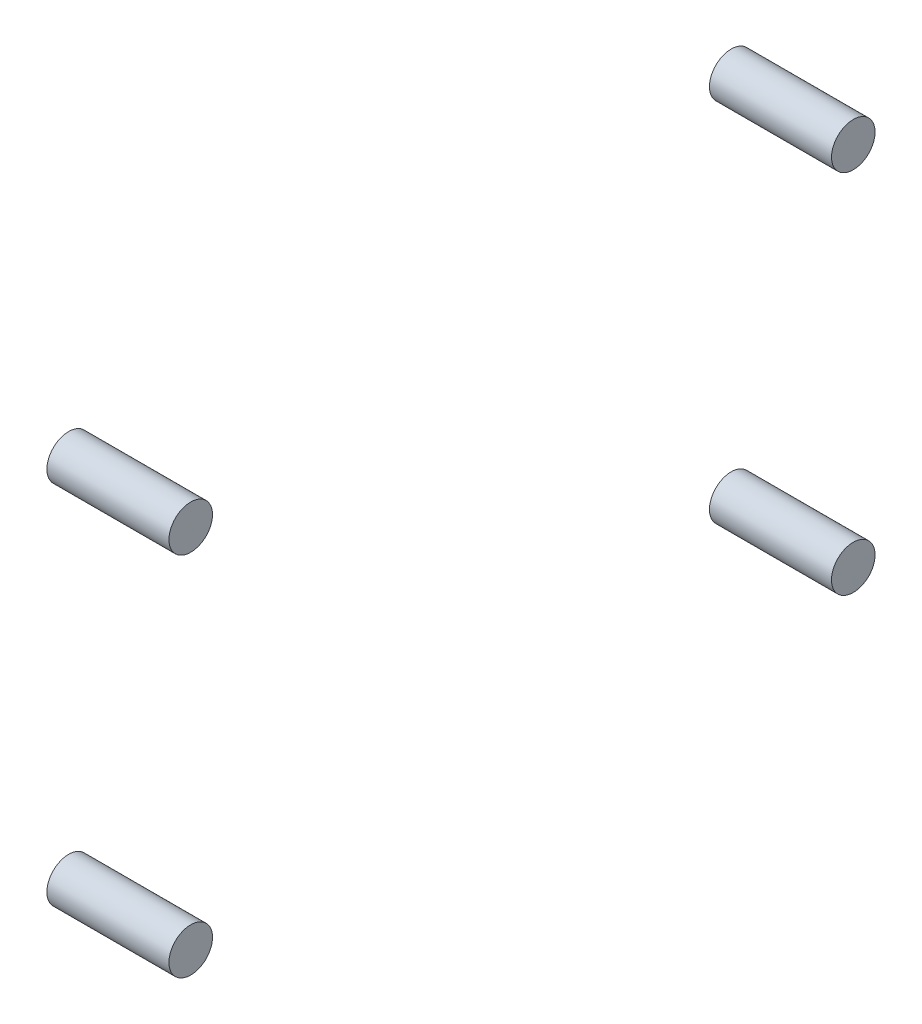
from build123d import *

# Parameters (mm, degrees)
SKETCH2_R                            = 1.25
BOSS_EXTRUDE1_DEPTH                  = 7
BOSS_EXTRUDE1_2_DEPTH                = 7
BOSS_EXTRUDE1_3_DEPTH                = 7
BOSS_EXTRUDE1_4_DEPTH                = 7
F_45_0_082_DIAMETER_HOLE1_AT_2_COUNT = 2
F_45_0_082_DIAMETER_HOLE1_AT_2_PITCH = 38
F_45_0_082_DIAMETER_HOLE1_AT_3_COUNT = 2
F_45_0_082_DIAMETER_HOLE1_AT_3_PITCH = 43.416586692
F_45_0_082_DIAMETER_HOLE1_AT_4_COUNT = 2
F_45_0_082_DIAMETER_HOLE1_AT_4_PITCH = 21


with BuildPart() as part:
    # Sketch2 → Boss-Extrude1 (new body)
    with BuildSketch(Plane(origin=(0, 0, 0), x_dir=(0, 0, -1), z_dir=(1, 0, 0))):
        with Locations((75.89, 6.426291501)):
            Circle(SKETCH2_R)
    extrude(amount=-BOSS_EXTRUDE1_DEPTH)


with BuildPart() as body_2:
    # Sketch2 → Boss-Extrude1 2 (new body)
    with BuildSketch(Plane(origin=(0, 0, 0), x_dir=(0, 0, -1), z_dir=(1, 0, 0))):
        with Locations((37.89, 6.426291501)):
            Circle(SKETCH2_R)
    extrude(amount=-BOSS_EXTRUDE1_2_DEPTH)


with BuildPart() as body_3:
    # Sketch2 → Boss-Extrude1 3 (new body)
    with BuildSketch(Plane(origin=(0, 0, 0), x_dir=(0, 0, -1), z_dir=(1, 0, 0))):
        with Locations((37.89, -14.573708499)):
            Circle(SKETCH2_R)
    extrude(amount=-BOSS_EXTRUDE1_3_DEPTH)

    # Sketch4 → #45 (0.082) Diameter Hole1 (revolve, cut)
    with BuildSketch(Plane(origin=(-7, -14.573708499, -37.89), x_dir=(0, 0, 1), z_dir=(0, 1, 0))):
        Polygon((0, 0), (0, 6), (1.0414, 5.374263751), (1.0414, 0), align=None)
    f_45_0_082_diameter_hole1 = revolve(axis=Axis((-13.35, -14.573708499, -37.89), (1, 0, 0)), mode=Mode.SUBTRACT)


with BuildPart() as body_4:
    # Sketch2 → Boss-Extrude1 4 (new body)
    with BuildSketch(Plane(origin=(0, 0, 0), x_dir=(0, 0, -1), z_dir=(1, 0, 0))):
        with Locations((75.89, -14.573708499)):
            Circle(SKETCH2_R)
    extrude(amount=-BOSS_EXTRUDE1_4_DEPTH)

    # #45 (0.082) Diameter Hole1 at 2: #45 (0.082) Diameter Hole1 ×2
    with Locations(*[(0, 0, -i * F_45_0_082_DIAMETER_HOLE1_AT_2_PITCH) for i in range(1, F_45_0_082_DIAMETER_HOLE1_AT_2_COUNT)]):
        add(f_45_0_082_diameter_hole1, mode=Mode.SUBTRACT)


with BuildPart() as part_1:
    add(part.part)

    # #45 (0.082) Diameter Hole1 at 3: #45 (0.082) Diameter Hole1 ×2
    with Locations(*[Vector(0, 0.4836861116901228, -0.8752415354392695) * (i * F_45_0_082_DIAMETER_HOLE1_AT_3_PITCH) for i in range(1, F_45_0_082_DIAMETER_HOLE1_AT_3_COUNT)]):
        add(f_45_0_082_diameter_hole1, mode=Mode.SUBTRACT)


with BuildPart() as body_2_1:
    add(body_2.part)

    # #45 (0.082) Diameter Hole1 at 4: #45 (0.082) Diameter Hole1 ×2
    with Locations(*[(0, i * F_45_0_082_DIAMETER_HOLE1_AT_4_PITCH, 0) for i in range(1, F_45_0_082_DIAMETER_HOLE1_AT_4_COUNT)]):
        add(f_45_0_082_diameter_hole1, mode=Mode.SUBTRACT)


solid = Compound([body_3.part, body_4.part, part_1.part, body_2_1.part])
